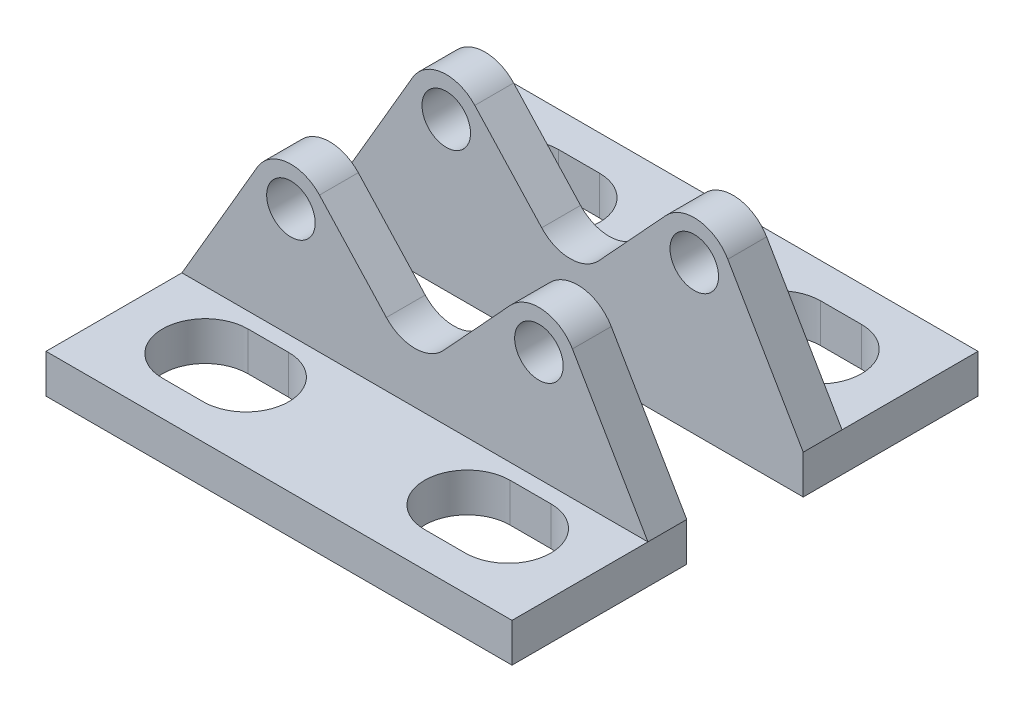
from build123d import *

# Parameters (mm, degrees)
SKETCH3_W               = 24
SKETCH3_H               = 7
BOSS_EXTRUDE2_DEPTH     = 2
BOSS_EXTRUDE2_2_DEPTH   = 2
BOSS_EXTRUDE3_DEPTH     = 2
FILLET3_R               = 2
CUT_EXTRUDE2_DEPTH      = 2
FILLET3_OF_MIRROR34_R   = 2
CUT_EXTRUDE3_DEPTH      = 23.939392052
CUT_EXTRUDE3_DEPTH_BACK = 23.939392052
SKETCH7_R               = 1.25


with BuildPart() as part:
    # Sketch3 → Boss-Extrude2 (new body)
    with BuildSketch(Plane(origin=(0, 0, 0), x_dir=(1, 0, 0), z_dir=(0, 1, 0))):
        with Locations((0, -8.5)):
            Rectangle(SKETCH3_W, SKETCH3_H)
    boss_extrude2 = extrude(amount=BOSS_EXTRUDE2_DEPTH)

    # Sketch5 → Boss-Extrude3 (add)
    with BuildSketch(Plane(origin=(0, 0, 5), x_dir=(-1, 0, 0), z_dir=(0, 0, -1))):
        Polygon((-12, 2), (-6.75, 11), (0, 3.679615637), (6.75, 11), (12, 2), (12, 0), (-12, 0), align=None)
    boss_extrude3 = extrude(amount=BOSS_EXTRUDE3_DEPTH)

    # Fillet3
    fillet3_edges = [part.edges().sort_by_distance(p)[0] for p in [
        (-6.75, 11, 4),
        (0, 3.679615637, 4),
        (6.75, 11, 4),
    ]]
    fillet(fillet3_edges, radius=FILLET3_R)


with BuildPart() as body_2:
    # Sketch3 → Boss-Extrude2 2 (new body)
    with BuildSketch(Plane(origin=(0, 0, 0), x_dir=(1, 0, 0), z_dir=(0, 1, 0))):
        with Locations((0, 8.5)):
            Rectangle(SKETCH3_W, SKETCH3_H)
    boss_extrude2_2 = extrude(amount=BOSS_EXTRUDE2_2_DEPTH)


with BuildPart() as cut_extrude2_tool:
    # Sketch4 → Cut-Extrude2 (new body)
    with BuildSketch(Plane(origin=(0, 2, 0), x_dir=(1, 0, 0), z_dir=(0, 1, 0))):
        with BuildLine():
            Line((-7.8, -5.8), (-5.7, -5.8))
            ThreePointArc((-5.7, -5.8), (-3.5, -8), (-5.7, -10.2))
            Line((-5.7, -10.2), (-7.8, -10.2))
            ThreePointArc((-7.8, -10.2), (-10, -8), (-7.8, -5.8))
        make_face()
        with BuildLine():
            Line((5.7, -10.2), (7.8, -10.2))
            ThreePointArc((7.8, -10.2), (10, -8), (7.8, -5.8))
            Line((7.8, -5.8), (5.7, -5.8))
            ThreePointArc((5.7, -5.8), (3.5, -8), (5.7, -10.2))
        make_face()
        with BuildLine():
            Line((-7.8, 5.8), (-5.7, 5.8))
            ThreePointArc((-5.7, 5.8), (-3.5, 8), (-5.7, 10.2))
            Line((-5.7, 10.2), (-7.8, 10.2))
            ThreePointArc((-7.8, 10.2), (-10, 8), (-7.8, 5.8))
        make_face()
        with BuildLine():
            Line((5.7, 10.2), (7.8, 10.2))
            ThreePointArc((7.8, 10.2), (10, 8), (7.8, 5.8))
            Line((7.8, 5.8), (5.7, 5.8))
            ThreePointArc((5.7, 5.8), (3.5, 8), (5.7, 10.2))
        make_face()
    cut_extrude2 = extrude(amount=-CUT_EXTRUDE2_DEPTH)


with BuildPart() as part_1:
    add(part.part)

    # Cut-Extrude2: cut by cut_extrude2_tool
    add(cut_extrude2_tool.part, mode=Mode.SUBTRACT)



with BuildPart() as body_2_1:
    add(body_2.part)

    # Cut-Extrude2: cut by cut_extrude2_tool
    add(cut_extrude2_tool.part, mode=Mode.SUBTRACT)


with BuildPart() as part_2:
    add(part_1.part)

    add(body_2_1.part)  # Mirror34 merges body 2
    # Mirror34: Boss-Extrude2, Boss-Extrude2 2, Boss-Extrude3 across plane
    add(boss_extrude2.mirror(Plane.XY))
    add(boss_extrude2_2.mirror(Plane.XY))
    add(boss_extrude3.mirror(Plane.XY))

    # Mirror34 2: Cut-Extrude2 across plane
    add(cut_extrude2.mirror(Plane.XY), mode=Mode.SUBTRACT)

    # Fillet3 of Mirror34
    fillet3_of_mirror34_edges = [part_2.edges().sort_by_distance(p)[0] for p in [
        (-6.75, 11, -4),
        (0, 3.679615637, -4),
        (6.75, 11, -4),
    ]]
    fillet(fillet3_of_mirror34_edges, radius=FILLET3_OF_MIRROR34_R)

    # Sketch7 → Cut-Extrude3 (cut, two sides: drawn at the far end of the back side and taken through both)
    with BuildSketch(Plane.XY.offset(5).offset(-CUT_EXTRUDE3_DEPTH_BACK)):
        with Locations((-6.38594288, 7.654828208)):
            Circle(SKETCH7_R)
        with Locations((6.38594288, 7.654828208)):
            Circle(SKETCH7_R)
    extrude(amount=CUT_EXTRUDE3_DEPTH + CUT_EXTRUDE3_DEPTH_BACK, mode=Mode.SUBTRACT)


solid = part_2.part
